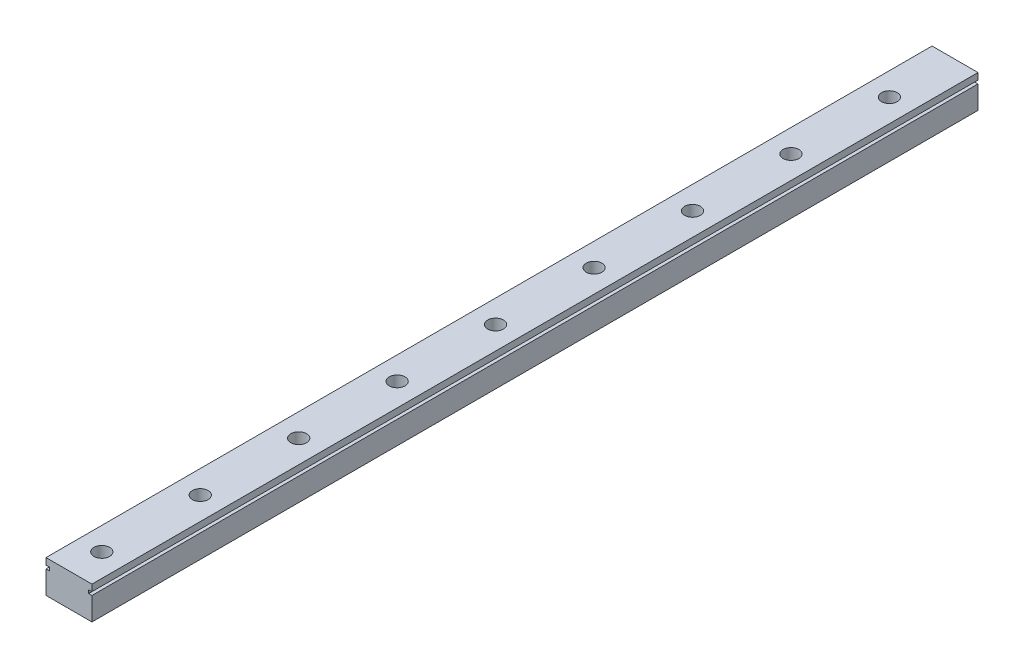
from build123d import *

# Parameters (mm, degrees)
BOSS_EXTRUDE1_DEPTH = 135
SKETCH2_R           = 1.2
CUT_EXTRUDE1_DEPTH  = 136.273796428


with BuildPart() as part:
    # Sketch1 → Boss-Extrude1 (new body)
    with BuildSketch(Plane.XY):
        Polygon((0, 4), (0, 5), (7, 5), (7, 4), (6.5, 4), (6.5, 3.5), (7, 3.5), (7, 0), (0, 0), (0, 3.5), (0.5, 3.5), (0.5, 4), align=None)
    extrude(amount=BOSS_EXTRUDE1_DEPTH)

    # Sketch2 → Cut-Extrude1 (cut, through all)
    with BuildSketch(Plane(origin=(0, 5, 0), x_dir=(1, 0, 0), z_dir=(0, 1, 0))):
        with Locations(Location((3.5, -130, 0), (0, 0, 270))):
            Circle(SKETCH2_R)
        with Locations(Location((3.5, -115, 0), (0, 0, 270))):
            Circle(SKETCH2_R)
        with Locations(Location((3.5, -100, 0), (0, 0, 270))):
            Circle(SKETCH2_R)
        with Locations(Location((3.5, -85, 0), (0, 0, 270))):
            Circle(SKETCH2_R)
        with Locations(Location((3.5, -70, 0), (0, 0, 270))):
            Circle(SKETCH2_R)
        with Locations(Location((3.5, -55, 0), (0, 0, 270))):
            Circle(SKETCH2_R)
        with Locations(Location((3.5, -40, 0), (0, 0, 270))):
            Circle(SKETCH2_R)
        with Locations(Location((3.5, -25, 0), (0, 0, 270))):
            Circle(SKETCH2_R)
        with Locations(Location((3.5, -10, 0), (0, 0, 270))):
            Circle(SKETCH2_R)
        with Locations((3.5, 5)):
            Circle(SKETCH2_R)
        with Locations((3.5, 20)):
            Circle(SKETCH2_R)
        with Locations((3.5, 35)):
            Circle(SKETCH2_R)
        with Locations((3.5, 50)):
            Circle(SKETCH2_R)
    extrude(amount=-CUT_EXTRUDE1_DEPTH, mode=Mode.SUBTRACT)


solid = part.part
